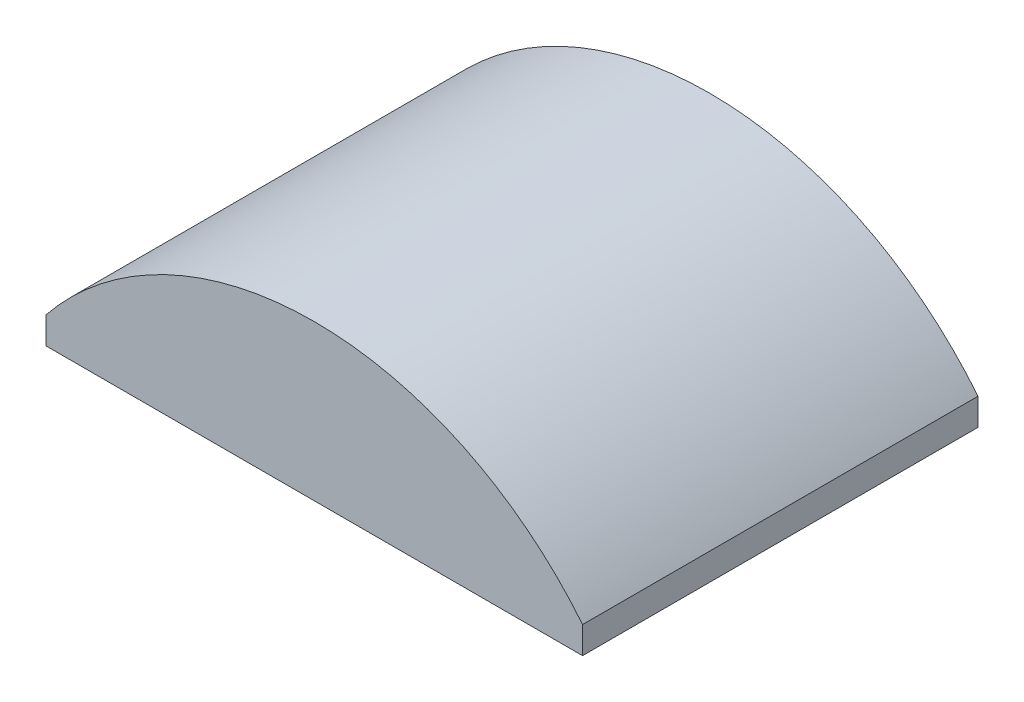
from build123d import *

# Parameters (mm, degrees)
SKETCH1_W           = 59.7
SKETCH1_H           = 3
BOSS_EXTRUDE1_DEPTH = 44
SKETCH2_R           = 3.5
SKETCH2_R_2         = 2.25
BOSS_EXTRUDE2_DEPTH = 9
CUT_EXTRUDE1_START  = -8
SKETCH3_R           = 6.2
SKETCH3_R_2         = 3.5
CUT_EXTRUDE1_DEPTH  = 8
CHAMFER1_SIZE       = 0.75


with BuildPart() as part:
    # Sketch1 → Boss-Extrude1 (new body)
    with BuildSketch(Plane.XY):
        with BuildLine():
            ThreePointArc((29.85, 3), (0, 17.273040059), (-29.85, 3))
            Line((-29.85, 3), (29.85, 3))
        make_face()
        with Locations((0, 1.5)):
            Rectangle(SKETCH1_W, SKETCH1_H)
    extrude(amount=BOSS_EXTRUDE1_DEPTH)

    # Sketch2 → Boss-Extrude2 (add)
    # profile 1 of 4: a face of its own
    with BuildSketch(Plane.XZ):
        with Locations(Location((8.838834765, 30.838834765, 0), (0, 0, 180))):
            Circle(SKETCH2_R)
        with Locations((8.838834765, 30.838834765)):
            Circle(SKETCH2_R_2, mode=Mode.SUBTRACT)
    # profile 2 of 4: a face of its own
    with BuildSketch(Plane.XZ):
        with Locations(Location((8.838834765, 13.161165235, 0), (0, 0, 180))):
            Circle(SKETCH2_R)
        with Locations((8.838834765, 13.161165235)):
            Circle(SKETCH2_R_2, mode=Mode.SUBTRACT)
    # profile 3 of 4: a face of its own
    with BuildSketch(Plane.XZ):
        with Locations(Location((-8.838834765, 13.161165235, 0), (0, 0, 180))):
            Circle(SKETCH2_R)
        with Locations((-8.838834765, 13.161165235)):
            Circle(SKETCH2_R_2, mode=Mode.SUBTRACT)
    # profile 4 of 4: a face of its own
    with BuildSketch(Plane.XZ):
        with Locations(Location((-8.838834765, 30.838834765, 0), (0, 0, 180))):
            Circle(SKETCH2_R)
        with Locations((-8.838834765, 30.838834765)):
            Circle(SKETCH2_R_2, mode=Mode.SUBTRACT)
    extrude(amount=BOSS_EXTRUDE2_DEPTH)

    # Sketch3 → Cut-Extrude1 (cut)
    # profile 1 of 4: a face of its own
    with BuildSketch(Plane.XZ.offset(CUT_EXTRUDE1_START)):
        with Locations((-8.838834765, 30.838834765)):
            Circle(SKETCH3_R)
        with Locations((-8.838834765, 30.838834765)):
            Circle(SKETCH3_R_2, mode=Mode.SUBTRACT)
    # profile 2 of 4: a face of its own
    with BuildSketch(Plane.XZ.offset(CUT_EXTRUDE1_START)):
        with Locations((8.838834765, 30.838834765)):
            Circle(SKETCH3_R)
        with Locations((8.838834765, 30.838834765)):
            Circle(SKETCH3_R_2, mode=Mode.SUBTRACT)
    # profile 3 of 4: a face of its own
    with BuildSketch(Plane.XZ.offset(CUT_EXTRUDE1_START)):
        with Locations((8.838834765, 13.161165235)):
            Circle(SKETCH3_R)
        with Locations((8.838834765, 13.161165235)):
            Circle(SKETCH3_R_2, mode=Mode.SUBTRACT)
    # profile 4 of 4: a face of its own
    with BuildSketch(Plane.XZ.offset(CUT_EXTRUDE1_START)):
        with Locations((-8.838834765, 13.161165235)):
            Circle(SKETCH3_R)
        with Locations((-8.838834765, 13.161165235)):
            Circle(SKETCH3_R_2, mode=Mode.SUBTRACT)
    extrude(amount=CUT_EXTRUDE1_DEPTH, mode=Mode.SUBTRACT)

    # Chamfer1
    chamfer1_edges = [part.edges().sort_by_distance(p)[0] for p in [
        (-15.038834765, 0, 13.161165235),
        (2.638834765, 0, 13.161165235),
        (2.638834765, 0, 30.838834765),
        (-15.038834765, 0, 30.838834765),
    ]]
    chamfer(chamfer1_edges, length=CHAMFER1_SIZE)


solid = part.part
